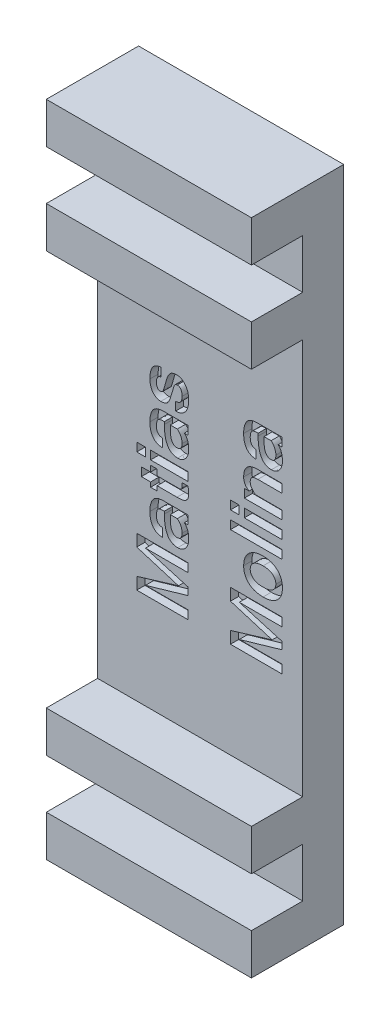
from build123d import *

# Parameters (mm, degrees)
CROQUIS1_W              = 64.2
CROQUIS1_H              = 20
SALIENTE_EXTRUIR1_DEPTH = 4
CROQUIS2_W              = 20
CROQUIS2_H              = 4
SALIENTE_EXTRUIR2_DEPTH = 5
CROQUIS3_W              = 3.653846154
CROQUIS3_H              = 0.833333333
CROQUIS3_W_2            = 0.833333333
CROQUIS3_H_2            = 0.833333334
CROQUIS3_W_3            = 5
CORTAR_EXTRUIR1_DEPTH   = 0.8


with BuildPart() as part:
    # Croquis1 → Saliente-Extruir1 (new body)
    with BuildSketch(Plane(origin=(0, 0, 0), x_dir=(0, 1, 0), z_dir=(0, 0, 1))):
        Rectangle(CROQUIS1_W, CROQUIS1_H)
    extrude(amount=SALIENTE_EXTRUIR1_DEPTH)

    # Croquis2 → Saliente-Extruir2 (add)
    with BuildSketch(Plane.XY.offset(4)):
        with Locations((0, 30.1)):
            Rectangle(CROQUIS2_W, CROQUIS2_H)
        with Locations((0, 21.3)):
            Rectangle(CROQUIS2_W, CROQUIS2_H)
        with Locations((0, -21.3)):
            Rectangle(CROQUIS2_W, CROQUIS2_H)
        with Locations((0, -30.1)):
            Rectangle(CROQUIS2_W, CROQUIS2_H)
    extrude(amount=SALIENTE_EXTRUIR2_DEPTH)

    # Croquis3 → Cortar-Extruir1 (cut)
    # profile 1 of 14: a face of its own
    with BuildSketch(Plane.XY.offset(4)):
        with BuildLine():
            add(Edge.make_bspline(
                [(-1.115384615, 8.646834936), (-1.11627259, 8.585703378), (-1.117993187, 8.467250931), (-1.133347455, 8.294947443), (-1.157835725, 8.133880089), (-1.192586317, 7.984022228), (-1.237966222, 7.845646553), (-1.292515095, 7.718143105), (-1.358078196, 7.601980122), (-1.433483045, 7.496995907), (-1.519218199, 7.403241303), (-1.614686657, 7.32033401), (-1.7213109, 7.25019565), (-1.83671428, 7.189547373), (-1.962845331, 7.141386501), (-2.099061003, 7.106218821), (-2.244599822, 7.079128982), (-2.345566408, 7.071981279), (-2.397435897, 7.068309295)],
                knots=[0, 0, 0, 0, 1.274858276, 2.470247585, 3.604862061, 4.670716368, 5.674910767, 6.638692114, 7.558604551, 8.451525249, 9.3289138, 10.20284102, 11.081637878, 11.984926025, 12.91737872, 13.890349518, 14.916210823, 16, 16, 16, 16], degree=3))
            Line((-2.397435897, 7.068309295), (-2.397435897, 7.898637821))
            add(Edge.make_bspline(
                [(-2.397435897, 7.898637821), (-2.371366204, 7.899578996), (-2.321076731, 7.901394562), (-2.248001482, 7.910485434), (-2.18004233, 7.924957251), (-2.117300395, 7.946741229), (-2.058907335, 7.971973714), (-2.006150394, 8.004966644), (-1.958047176, 8.042561266), (-1.91551099, 8.086759063), (-1.876903669, 8.135543734), (-1.845582503, 8.19157563), (-1.816548883, 8.251630028), (-1.795643806, 8.31835598), (-1.77649672, 8.38995695), (-1.765948948, 8.46766613), (-1.756774358, 8.550800027), (-1.756534715, 8.608074893), (-1.756410256, 8.637820513)],
                knots=[0, 0, 0, 0, 1.119044826, 2.158681889, 3.156401843, 4.094304959, 5.005000581, 5.879824236, 6.756991382, 7.618216221, 8.50666161, 9.418371056, 10.367046892, 11.363840505, 12.413304224, 13.544028895, 14.724494894, 16, 16, 16, 16], degree=3))
            add(Edge.make_bspline(
                [(-1.756410256, 8.637820513), (-1.757485609, 8.694385955), (-1.759503524, 8.800531886), (-1.786159906, 8.948332415), (-1.826220855, 9.075387069), (-1.887606141, 9.178014535), (-1.959772308, 9.25832855), (-2.040902678, 9.316571971), (-2.130744351, 9.353228906), (-2.194107208, 9.357044226), (-2.226161859, 9.358974359)],
                knots=[0, 0, 0, 0, 1.411897524, 2.649447631, 3.741983836, 4.722344115, 5.614331132, 6.422426071, 7.201920735, 8, 8, 8, 8], degree=3))
            add(Edge.make_bspline(
                [(-2.226161859, 9.358974359), (-2.256841907, 9.356989049), (-2.315740746, 9.353177698), (-2.398007565, 9.319937587), (-2.464338237, 9.261875993), (-2.505486946, 9.195997442), (-2.535112328, 9.130821811), (-2.558373018, 9.0660706), (-2.585571738, 8.988440194), (-2.61438159, 8.896417762), (-2.646657128, 8.791163436), (-2.678895222, 8.671541616), (-2.715743404, 8.538963513), (-2.752187896, 8.395729559), (-2.789192754, 8.250167123), (-2.830592679, 8.111278517), (-2.873772243, 7.982160333), (-2.917262451, 7.862338343), (-2.962574068, 7.7523435), (-3.009140732, 7.652080877), (-3.058547091, 7.562124963), (-3.108047572, 7.480164261), (-3.164943121, 7.408496537), (-3.230922809, 7.346595932), (-3.3067047, 7.29397982), (-3.393080952, 7.252093486), (-3.488523706, 7.218953069), (-3.593831414, 7.196458101), (-3.708481194, 7.182272142), (-3.788283032, 7.180439138), (-3.829727564, 7.179487179)],
                knots=[0, 0, 0, 0, 0.863129502, 1.657015847, 2.45162784, 3.308260965, 3.826504937, 4.470134582, 5.247372209, 6.14672411, 7.189353247, 8.352192128, 9.640553054, 11.070264348, 12.520572451, 13.876173487, 15.156595342, 16.360126907, 17.470542969, 18.511001246, 19.475940451, 20.364281286, 21.208402056, 22.047782609, 22.90715432, 23.79992581, 24.746917346, 25.749884874, 26.831418294, 28, 28, 28, 28], degree=3))
            add(Edge.make_bspline(
                [(-3.829727564, 7.179487179), (-3.867513296, 7.180711659), (-3.94213595, 7.183129872), (-4.051473525, 7.200180257), (-4.155709243, 7.229427422), (-4.254654037, 7.270743948), (-4.348082321, 7.324448824), (-4.437064282, 7.388902304), (-4.520111165, 7.465730916), (-4.598200282, 7.552702616), (-4.668795521, 7.649239762), (-4.730573282, 7.754113413), (-4.781241569, 7.867380805), (-4.82445594, 7.98707159), (-4.857738581, 8.114440216), (-4.8801984, 8.249220616), (-4.89451535, 8.391452705), (-4.896448259, 8.488880298), (-4.897435897, 8.538661859)],
                knots=[0, 0, 0, 0, 0.937501419, 1.85146193, 2.737974475, 3.618076305, 4.504898495, 5.406382434, 6.338744809, 7.306791239, 8.302692004, 9.30158631, 10.321155683, 11.377232385, 12.45632588, 13.582723878, 14.764869639, 16, 16, 16, 16], degree=3))
            add(Edge.make_bspline(
                [(-4.897435897, 8.538661859), (-4.896830007, 8.599121401), (-4.895656864, 8.716185065), (-4.882013721, 8.885993713), (-4.861924747, 9.044395825), (-4.831543071, 9.191214934), (-4.794074464, 9.327150701), (-4.747011646, 9.451485341), (-4.691946858, 9.564888379), (-4.62779546, 9.666360612), (-4.555155902, 9.756777412), (-4.47341236, 9.835118133), (-4.383819514, 9.903287392), (-4.284646207, 9.958205664), (-4.177499101, 10.002682016), (-4.061923992, 10.035598802), (-3.93761722, 10.056778551), (-3.8518454, 10.061613605), (-3.807692308, 10.064102564)],
                knots=[0, 0, 0, 0, 1.367365615, 2.647536268, 3.851350999, 4.977077753, 6.036310001, 7.037856784, 7.980246229, 8.883318511, 9.747925151, 10.597221918, 11.43858983, 12.28734911, 13.154163106, 14.057772132, 15.000191842, 16, 16, 16, 16], degree=3))
            Line((-3.807692308, 10.064102564), (-3.807692308, 9.234775641))
            add(Edge.make_bspline(
                [(-3.807692308, 9.234775641), (-3.843102295, 9.230708708), (-3.911090884, 9.222900034), (-4.004671901, 9.185508845), (-4.084165932, 9.130210977), (-4.148913241, 9.055507834), (-4.197824703, 8.962117219), (-4.232250556, 8.851183371), (-4.253079954, 8.722395045), (-4.255254168, 8.630561288), (-4.256410256, 8.581730769)],
                knots=[0, 0, 0, 0, 0.959694718, 1.842652138, 2.691195296, 3.554385987, 4.486891277, 5.519795609, 6.681207509, 8, 8, 8, 8], degree=3))
            add(Edge.make_bspline(
                [(-4.256410256, 8.581730769), (-4.255164618, 8.541623125), (-4.252787083, 8.465070155), (-4.237438148, 8.355500636), (-4.209012125, 8.258062107), (-4.172408758, 8.171710964), (-4.121414444, 8.10029961), (-4.054182022, 8.048994237), (-3.973474497, 8.017836318), (-3.915148389, 8.014536562), (-3.884815705, 8.012820513)],
                knots=[0, 0, 0, 0, 1.25823482, 2.401577435, 3.458855629, 4.433896374, 5.332433797, 6.176535344, 7.051701226, 8, 8, 8, 8], degree=3))
            add(Edge.make_bspline(
                [(-3.884815705, 8.012820513), (-3.855948788, 8.01423498), (-3.80182014, 8.016887263), (-3.726930401, 8.039575866), (-3.667105586, 8.080330573), (-3.62877822, 8.128578181), (-3.60483902, 8.180782856), (-3.583262958, 8.235766595), (-3.557863245, 8.306373763), (-3.531544878, 8.393126849), (-3.502545077, 8.495743454), (-3.470648837, 8.613980673), (-3.435227183, 8.748026519), (-3.400240859, 8.894531894), (-3.361432, 9.044054879), (-3.319384999, 9.188359488), (-3.27565097, 9.323439305), (-3.229465049, 9.449043093), (-3.181650497, 9.565116168), (-3.131807472, 9.672108961), (-3.078197131, 9.768782826), (-3.024930867, 9.858446546), (-2.964424293, 9.938377497), (-2.893892743, 10.006487899), (-2.8144739, 10.064671514), (-2.726021405, 10.111586014), (-2.628304451, 10.147949926), (-2.522006448, 10.173306102), (-2.406643333, 10.190049824), (-2.32671919, 10.19153646), (-2.28525641, 10.192307692)],
                knots=[0, 0, 0, 0, 0.813591058, 1.525572814, 2.176145675, 2.826377475, 3.235022827, 3.793015424, 4.493184449, 5.351255931, 6.350143211, 7.501813857, 8.806398842, 10.261703319, 11.751355635, 13.164309599, 14.501806511, 15.756465784, 16.939003115, 18.042997575, 19.084203938, 20.05676159, 20.983728313, 21.903005423, 22.813017982, 23.752771056, 24.718553773, 25.746638945, 26.831008876, 28, 28, 28, 28], degree=3))
            add(Edge.make_bspline(
                [(-2.28525641, 10.192307692), (-2.24542352, 10.191381783), (-2.166568427, 10.189548807), (-2.050892177, 10.16794931), (-1.938985842, 10.137112699), (-1.833162264, 10.089445874), (-1.730757057, 10.03141604), (-1.634037336, 9.958566093), (-1.540832226, 9.873958136), (-1.454598958, 9.775725639), (-1.374697678, 9.667617285), (-1.305085306, 9.549055461), (-1.245715754, 9.421392909), (-1.19805006, 9.284020314), (-1.16101028, 9.137513678), (-1.134143156, 8.982185897), (-1.117869916, 8.817456502), (-1.116226496, 8.704632001), (-1.115384615, 8.646834936)],
                knots=[0, 0, 0, 0, 0.882602084, 1.747241267, 2.602949964, 3.452093025, 4.314826315, 5.209653044, 6.132463519, 7.103174052, 8.104710206, 9.110865097, 10.148167667, 11.22346815, 12.331959974, 13.497398446, 14.717982156, 16, 16, 16, 16], degree=3))
        make_face()
    # profile 2 of 14: a face of its own
    with BuildSketch(Plane.XY.offset(4)):
        with BuildLine():
            add(Edge.make_bspline(
                [(-1.541065705, 5.641025641), (-1.506632787, 5.610657325), (-1.4373662, 5.549567248), (-1.351318666, 5.437889254), (-1.277743229, 5.312693249), (-1.217726148, 5.172664073), (-1.171947917, 5.017939393), (-1.139407892, 4.848876018), (-1.11928097, 4.665279932), (-1.116712673, 4.537981166), (-1.115384615, 4.472155449)],
                knots=[0, 0, 0, 0, 0.855394567, 1.720744712, 2.617573961, 3.561176124, 4.556936916, 5.62402994, 6.771394744, 8, 8, 8, 8], degree=3))
            add(Edge.make_bspline(
                [(-1.115384615, 4.472155449), (-1.116386004, 4.427378505), (-1.118356402, 4.339272441), (-1.132662744, 4.210370954), (-1.155200343, 4.087229016), (-1.188833825, 3.970473831), (-1.230420229, 3.859290192), (-1.282121066, 3.753992884), (-1.342989956, 3.654909102), (-1.413270222, 3.563088961), (-1.489731353, 3.478936677), (-1.573008882, 3.405172765), (-1.662838231, 3.343889143), (-1.757992587, 3.293415131), (-1.858163235, 3.252970727), (-1.964447083, 3.224785315), (-2.076443401, 3.208932509), (-2.152995572, 3.206414632), (-2.192107372, 3.205128205)],
                knots=[0, 0, 0, 0, 1.153781604, 2.270256715, 3.338475667, 4.376179815, 5.397342921, 6.393996888, 7.394543108, 8.38922663, 9.369704209, 10.320783555, 11.249173626, 12.165281484, 13.0919954, 14.027020461, 14.991971372, 16, 16, 16, 16], degree=3))
            add(Edge.make_bspline(
                [(-2.192107372, 3.205128205), (-2.244618657, 3.206937453), (-2.346591614, 3.210450876), (-2.494631807, 3.235448395), (-2.632249137, 3.279098203), (-2.760371662, 3.339084434), (-2.877866481, 3.417384273), (-2.984820125, 3.512603021), (-3.081837258, 3.625040434), (-3.167360893, 3.755194168), (-3.244360579, 3.901485468), (-3.308256513, 4.065951091), (-3.364715006, 4.246138691), (-3.408830765, 4.443984011), (-3.445211996, 4.658189685), (-3.469317688, 4.890373481), (-3.484547474, 5.13934991), (-3.486284597, 5.311140449), (-3.487179487, 5.399639423)],
                knots=[0, 0, 0, 0, 0.878585857, 1.706147509, 2.503042316, 3.287780321, 4.065646792, 4.857176963, 5.677084264, 6.543272501, 7.457907148, 8.438311437, 9.491500693, 10.615026604, 11.827426016, 13.125539691, 14.519203723, 16, 16, 16, 16], degree=3))
            Line((-3.487179487, 5.399639423), (-3.487179487, 5.641025641))
            add(Edge.make_bspline(
                [(-3.487179487, 5.641025641), (-3.531593976, 5.640788735), (-3.614811994, 5.64034485), (-3.731141099, 5.633372615), (-3.830438625, 5.62247029), (-3.91538854, 5.608896877), (-3.989886865, 5.583570691), (-4.054891647, 5.540801034), (-4.113790547, 5.48355978), (-4.155962691, 5.423968134), (-4.184723804, 5.367210105), (-4.204796291, 5.317461325), (-4.220589362, 5.260606691), (-4.232993795, 5.197558322), (-4.244756918, 5.12820534), (-4.250655493, 5.051813497), (-4.256507287, 4.96903767), (-4.256443325, 4.911538353), (-4.256410256, 4.881810897)],
                knots=[0, 0, 0, 0, 1.644116973, 3.08052978, 4.311738224, 5.342108045, 6.26085966, 7.200330182, 8.196856224, 9.28744565, 9.884466287, 10.550093353, 11.269973002, 12.065083005, 12.928719252, 13.872084642, 14.899856358, 16, 16, 16, 16], degree=3))
            add(Edge.make_bspline(
                [(-4.256410256, 4.881810897), (-4.25491331, 4.827261344), (-4.252090931, 4.72441225), (-4.225259555, 4.580380295), (-4.180881689, 4.456511308), (-4.116585521, 4.353410309), (-4.033920981, 4.270524753), (-3.930981991, 4.211920199), (-3.811314108, 4.172882519), (-3.724880697, 4.165523499), (-3.679487179, 4.161658654)],
                knots=[0, 0, 0, 0, 1.25244733, 2.361395547, 3.351831856, 4.258594298, 5.132028351, 6.012309286, 6.95609496, 8, 8, 8, 8], degree=3))
            Line((-3.679487179, 4.161658654), (-3.679487179, 3.333333333))
            add(Edge.make_bspline(
                [(-3.679487179, 3.333333333), (-3.72867053, 3.337479197), (-3.824595624, 3.345565113), (-3.963120795, 3.371776673), (-4.092244296, 3.408913994), (-4.21237657, 3.456454388), (-4.321847291, 3.517584548), (-4.423413227, 3.587391434), (-4.513715916, 3.670767501), (-4.595890799, 3.764214805), (-4.666349591, 3.870348043), (-4.729480652, 3.986240587), (-4.780795149, 4.114282924), (-4.824181151, 4.252828156), (-4.856564324, 4.402768782), (-4.880688445, 4.563312601), (-4.894503086, 4.735335376), (-4.896437392, 4.853741548), (-4.897435897, 4.914863782)],
                knots=[0, 0, 0, 0, 1.050977601, 2.049781577, 2.99746369, 3.91012087, 4.795086313, 5.663286632, 6.529269919, 7.406455359, 8.307986408, 9.23723272, 10.213315296, 11.241396003, 12.326850323, 13.477593605, 14.697913189, 16, 16, 16, 16], degree=3))
            add(Edge.make_bspline(
                [(-4.897435897, 4.914863782), (-4.896332308, 4.974311356), (-4.894184428, 5.090012293), (-4.881656048, 5.258698485), (-4.858533072, 5.417258181), (-4.826790674, 5.565967741), (-4.785718895, 5.704639347), (-4.736090857, 5.833806414), (-4.675288259, 5.951939115), (-4.60766826, 6.062040867), (-4.525966701, 6.160846842), (-4.42727238, 6.245733906), (-4.312850969, 6.316939959), (-4.183119075, 6.375229684), (-4.037740343, 6.420042165), (-3.876528939, 6.451091541), (-3.700056713, 6.471836551), (-3.577054239, 6.473497179), (-3.513221154, 6.474358974)],
                knots=[0, 0, 0, 0, 1.182221406, 2.300920244, 3.360949907, 4.366238217, 5.322011343, 6.234346775, 7.113215819, 7.960524052, 8.799520271, 9.651419869, 10.537431668, 11.470404731, 12.472025255, 13.555313917, 14.731311242, 16, 16, 16, 16], degree=3))
            Line((-3.513221154, 6.474358974), (-1.179487179, 6.474358974))
            Line((-1.179487179, 6.474358974), (-1.179487179, 5.641025641))
            Line((-1.179487179, 5.641025641), (-1.541065705, 5.641025641))
        make_face()
        with BuildLine():
            Line((-2.224158654, 5.641025641), (-2.91025641, 5.641025641))
            Line((-2.91025641, 5.641025641), (-2.91025641, 5.275440705))
            add(Edge.make_bspline(
                [(-2.91025641, 5.275440705), (-2.909543164, 5.225353099), (-2.90816827, 5.12880145), (-2.901489884, 4.988421865), (-2.889066347, 4.857935277), (-2.869294256, 4.737148738), (-2.847290165, 4.625386987), (-2.817887281, 4.523928739), (-2.785650816, 4.431007541), (-2.744792467, 4.349258206), (-2.701681747, 4.275500208), (-2.651742747, 4.212190698), (-2.596307192, 4.158853182), (-2.535989464, 4.114136507), (-2.470087329, 4.079706604), (-2.399166731, 4.055540249), (-2.322879332, 4.041353825), (-2.270293424, 4.039445266), (-2.243189103, 4.038461538)],
                knots=[0, 0, 0, 0, 1.529328906, 2.948019231, 4.289925179, 5.528381479, 6.683893214, 7.764835549, 8.751552507, 9.681565107, 10.550406705, 11.355950243, 12.134535201, 12.892974516, 13.64072085, 14.395038928, 15.172755935, 16, 16, 16, 16], degree=3))
            add(Edge.make_bspline(
                [(-2.243189103, 4.038461538), (-2.203529057, 4.03996469), (-2.128806553, 4.04279674), (-2.025217965, 4.075032265), (-1.937542498, 4.126738736), (-1.869605276, 4.201743651), (-1.818375963, 4.293253691), (-1.781948076, 4.399115164), (-1.75953474, 4.519633725), (-1.757489693, 4.604594372), (-1.756410256, 4.649439103)],
                knots=[0, 0, 0, 0, 1.067041362, 2.010386014, 2.895840859, 3.782028924, 4.706289548, 5.709405297, 6.790956669, 8, 8, 8, 8], degree=3))
            add(Edge.make_bspline(
                [(-1.756410256, 4.649439103), (-1.757844172, 4.698629463), (-1.760701644, 4.796654833), (-1.78710299, 4.941745224), (-1.828197806, 5.083801776), (-1.884925388, 5.220716997), (-1.954292343, 5.348477242), (-2.032599897, 5.463714436), (-2.122752946, 5.561685981), (-2.190687293, 5.614837703), (-2.224158654, 5.641025641)],
                knots=[0, 0, 0, 0, 1.039455182, 2.071401351, 3.108191289, 4.162409493, 5.198694425, 6.177992556, 7.102294042, 8, 8, 8, 8], degree=3))
        make_face(mode=Mode.SUBTRACT)
    # profile 3 of 14: a face of its own
    with BuildSketch(Plane.XY.offset(4)):
        with Locations((-3.006410256, 2.147435898)):
            Rectangle(CROQUIS3_W, CROQUIS3_H)
    # profile 4 of 14: a face of its own
    with BuildSketch(Plane.XY.offset(4)):
        with Locations((-5.762820513, 2.147435898)):
            Rectangle(CROQUIS3_W_2, CROQUIS3_H)
    # profile 5 of 14: a face of its own
    with BuildSketch(Plane.XY.offset(4)):
        with BuildLine():
            add(Edge.make_bspline(
                [(-1.179487179, 1.346153846), (-1.169631898, 1.294822278), (-1.150373381, 1.194513631), (-1.13070007, 1.046389533), (-1.117859115, 0.905008718), (-1.116194447, 0.812993136), (-1.115384615, 0.768229167)],
                knots=[0, 0, 0, 0, 1.076808748, 2.104226135, 3.077739225, 4, 4, 4, 4], degree=3))
            add(Edge.make_bspline(
                [(-1.115384615, 0.768229167), (-1.115666802, 0.735496221), (-1.116214609, 0.671951982), (-1.123360469, 0.579640004), (-1.134975397, 0.493577689), (-1.152150259, 0.414333814), (-1.172983194, 0.341490233), (-1.198706857, 0.275181441), (-1.230161551, 0.215728296), (-1.27596427, 0.145842282), (-1.343516724, 0.072115683), (-1.434007655, -0.000930459), (-1.536631298, -0.052690025), (-1.650211739, -0.085647433), (-1.777335318, -0.103959653), (-1.92075697, -0.117650266), (-2.083153748, -0.126782519), (-2.197770397, -0.127713944), (-2.258213141, -0.128205128)],
                knots=[0, 0, 0, 0, 0.918229514, 1.782552509, 2.595982955, 3.352975044, 4.055555418, 4.720070844, 5.344414967, 5.939395419, 7.06043623, 8.134299426, 9.185867171, 10.261689824, 11.438301623, 12.784292742, 14.30420648, 16, 16, 16, 16], degree=3))
            Line((-2.258213141, -0.128205128), (-4.192307692, -0.128205128))
            Line((-4.192307692, -0.128205128), (-4.192307692, -0.576923077))
            Line((-4.192307692, -0.576923077), (-4.833333333, -0.576923077))
            Line((-4.833333333, -0.576923077), (-4.833333333, -0.128205128))
            Line((-4.833333333, -0.128205128), (-5.730769231, -0.128205128))
            Line((-5.730769231, -0.128205128), (-5.730769231, 0.705128205))
            Line((-5.730769231, 0.705128205), (-4.833333333, 0.705128205))
            Line((-4.833333333, 0.705128205), (-4.833333333, 1.282051282))
            Line((-4.833333333, 1.282051282), (-4.192307692, 1.282051282))
            Line((-4.192307692, 1.282051282), (-4.192307692, 0.705128205))
            Line((-4.192307692, 0.705128205), (-2.244190705, 0.705128205))
            add(Edge.make_bspline(
                [(-2.244190705, 0.705128205), (-2.216477299, 0.705306882), (-2.163703451, 0.70564713), (-2.089200705, 0.708512302), (-2.02338009, 0.713488442), (-1.966480555, 0.720073829), (-1.918386425, 0.729242691), (-1.878535298, 0.738704813), (-1.847187922, 0.750784433), (-1.818964902, 0.77145498), (-1.794147974, 0.799532942), (-1.772584523, 0.835248421), (-1.7584253, 0.873035083), (-1.757081865, 0.899319743), (-1.756410256, 0.912459936)],
                knots=[0, 0, 0, 0, 1.67959369, 3.198402281, 4.517536811, 5.679573791, 6.667760061, 7.482438328, 8.16263397, 8.684827803, 9.587254667, 10.413163521, 11.206710772, 12, 12, 12, 12], degree=3))
            add(Edge.make_bspline(
                [(-1.756410256, 0.912459936), (-1.757032015, 0.940504656), (-1.758401738, 1.002286687), (-1.761722563, 1.102906117), (-1.772021509, 1.219297066), (-1.778828218, 1.302081627), (-1.782451923, 1.346153846)],
                knots=[0, 0, 0, 0, 0.774575125, 1.706375525, 2.778937534, 4, 4, 4, 4], degree=3))
            Line((-1.782451923, 1.346153846), (-1.179487179, 1.346153846))
        make_face()
    # profile 6 of 14: a face of its own
    with BuildSketch(Plane.XY.offset(4)):
        with BuildLine():
            add(Edge.make_bspline(
                [(-1.541065705, -1.923076923), (-1.506632787, -1.953445239), (-1.4373662, -2.014535316), (-1.351318666, -2.12621331), (-1.277743229, -2.251409315), (-1.217726148, -2.391438491), (-1.171947917, -2.546163171), (-1.139407892, -2.715226547), (-1.11928097, -2.898822633), (-1.116712673, -3.026121398), (-1.115384615, -3.091947115)],
                knots=[0, 0, 0, 0, 0.855394567, 1.720744712, 2.617573961, 3.561176124, 4.556936916, 5.62402994, 6.771394744, 8, 8, 8, 8], degree=3))
            add(Edge.make_bspline(
                [(-1.115384615, -3.091947115), (-1.116386004, -3.136724059), (-1.118356402, -3.224830123), (-1.132662744, -3.35373161), (-1.155200343, -3.476873548), (-1.188833825, -3.593628733), (-1.230420229, -3.704812372), (-1.282121066, -3.81010968), (-1.342989956, -3.909193462), (-1.413270222, -4.001013603), (-1.489731353, -4.085165887), (-1.573008882, -4.158929799), (-1.662838231, -4.220213421), (-1.757992587, -4.270687433), (-1.858163235, -4.311131837), (-1.964447083, -4.339317249), (-2.076443401, -4.355170055), (-2.152995572, -4.357687933), (-2.192107372, -4.358974359)],
                knots=[0, 0, 0, 0, 1.153781604, 2.270256715, 3.338475667, 4.376179815, 5.397342921, 6.393996888, 7.394543108, 8.38922663, 9.369704209, 10.320783555, 11.249173626, 12.165281484, 13.0919954, 14.027020461, 14.991971372, 16, 16, 16, 16], degree=3))
            add(Edge.make_bspline(
                [(-2.192107372, -4.358974359), (-2.244618657, -4.357165111), (-2.346591614, -4.353651688), (-2.494631807, -4.328654169), (-2.632249137, -4.285004361), (-2.760371662, -4.22501813), (-2.877866481, -4.146718291), (-2.984820125, -4.051499543), (-3.081837258, -3.93906213), (-3.167360893, -3.808908396), (-3.244360579, -3.662617096), (-3.308256513, -3.498151473), (-3.364715006, -3.317963873), (-3.408830765, -3.120118553), (-3.445211996, -2.905912879), (-3.469317688, -2.673729083), (-3.484547474, -2.424752654), (-3.486284597, -2.252962115), (-3.487179487, -2.164463141)],
                knots=[0, 0, 0, 0, 0.878585857, 1.706147509, 2.503042316, 3.287780321, 4.065646792, 4.857176963, 5.677084264, 6.543272501, 7.457907148, 8.438311437, 9.491500693, 10.615026604, 11.827426016, 13.125539691, 14.519203723, 16, 16, 16, 16], degree=3))
            Line((-3.487179487, -2.164463141), (-3.487179487, -1.923076923))
            add(Edge.make_bspline(
                [(-3.487179487, -1.923076923), (-3.531593976, -1.92331383), (-3.614811994, -1.923757714), (-3.731141099, -1.930729949), (-3.830438625, -1.941632274), (-3.91538854, -1.955205687), (-3.989886865, -1.980531873), (-4.054891647, -2.023301531), (-4.113790547, -2.080542784), (-4.155962691, -2.14013443), (-4.184723804, -2.196892459), (-4.204796291, -2.246641239), (-4.220589362, -2.303495873), (-4.232993795, -2.366544242), (-4.244756918, -2.435897224), (-4.250655493, -2.512289067), (-4.256507287, -2.595064894), (-4.256443325, -2.652564211), (-4.256410256, -2.682291667)],
                knots=[0, 0, 0, 0, 1.644116973, 3.08052978, 4.311738224, 5.342108045, 6.26085966, 7.200330182, 8.196856224, 9.28744565, 9.884466287, 10.550093353, 11.269973002, 12.065083005, 12.928719252, 13.872084642, 14.899856358, 16, 16, 16, 16], degree=3))
            add(Edge.make_bspline(
                [(-4.256410256, -2.682291667), (-4.25491331, -2.73684122), (-4.252090931, -2.839690314), (-4.225259555, -2.983722269), (-4.180881689, -3.107591256), (-4.116585521, -3.210692255), (-4.033920981, -3.293577811), (-3.930981991, -3.352182365), (-3.811314108, -3.391220045), (-3.724880697, -3.398579065), (-3.679487179, -3.40244391)],
                knots=[0, 0, 0, 0, 1.25244733, 2.361395547, 3.351831856, 4.258594298, 5.132028351, 6.012309286, 6.95609496, 8, 8, 8, 8], degree=3))
            Line((-3.679487179, -3.40244391), (-3.679487179, -4.230769231))
            add(Edge.make_bspline(
                [(-3.679487179, -4.230769231), (-3.72867053, -4.226623367), (-3.824595624, -4.218537451), (-3.963120795, -4.192325891), (-4.092244296, -4.15518857), (-4.21237657, -4.107648176), (-4.321847291, -4.046518016), (-4.423413227, -3.97671113), (-4.513715916, -3.893335063), (-4.595890799, -3.799887759), (-4.666349591, -3.693754521), (-4.729480652, -3.577861977), (-4.780795149, -3.44981964), (-4.824181151, -3.311274408), (-4.856564324, -3.161333783), (-4.880688445, -3.000789963), (-4.894503086, -2.828767189), (-4.896437392, -2.710361016), (-4.897435897, -2.649238782)],
                knots=[0, 0, 0, 0, 1.050977601, 2.049781577, 2.99746369, 3.91012087, 4.795086313, 5.663286632, 6.529269919, 7.406455359, 8.307986408, 9.23723272, 10.213315296, 11.241396003, 12.326850323, 13.477593605, 14.697913189, 16, 16, 16, 16], degree=3))
            add(Edge.make_bspline(
                [(-4.897435897, -2.649238782), (-4.896332308, -2.589791209), (-4.894184428, -2.474090271), (-4.881656048, -2.305404079), (-4.858533072, -2.146844383), (-4.826790674, -1.998134823), (-4.785718895, -1.859463217), (-4.736090857, -1.73029615), (-4.675288259, -1.612163449), (-4.60766826, -1.502061697), (-4.525966701, -1.403255722), (-4.42727238, -1.318368659), (-4.312850969, -1.247162605), (-4.183119075, -1.18887288), (-4.037740343, -1.144060399), (-3.876528939, -1.113011023), (-3.700056713, -1.092266013), (-3.577054239, -1.090605385), (-3.513221154, -1.08974359)],
                knots=[0, 0, 0, 0, 1.182221406, 2.300920244, 3.360949907, 4.366238217, 5.322011343, 6.234346775, 7.113215819, 7.960524052, 8.799520271, 9.651419869, 10.537431668, 11.470404731, 12.472025255, 13.555313917, 14.731311242, 16, 16, 16, 16], degree=3))
            Line((-3.513221154, -1.08974359), (-1.179487179, -1.08974359))
            Line((-1.179487179, -1.08974359), (-1.179487179, -1.923076923))
            Line((-1.179487179, -1.923076923), (-1.541065705, -1.923076923))
        make_face()
        with BuildLine():
            Line((-2.224158654, -1.923076923), (-2.91025641, -1.923076923))
            Line((-2.91025641, -1.923076923), (-2.91025641, -2.288661859))
            add(Edge.make_bspline(
                [(-2.91025641, -2.288661859), (-2.909543164, -2.338749466), (-2.90816827, -2.435301114), (-2.901489884, -2.575680699), (-2.889066347, -2.706167288), (-2.869294256, -2.826953826), (-2.847290165, -2.938715577), (-2.817887281, -3.040173825), (-2.785650816, -3.133095023), (-2.744792467, -3.214844358), (-2.701681747, -3.288602356), (-2.651742747, -3.351911866), (-2.596307192, -3.405249382), (-2.535989464, -3.449966057), (-2.470087329, -3.48439596), (-2.399166731, -3.508562315), (-2.322879332, -3.522748739), (-2.270293424, -3.524657298), (-2.243189103, -3.525641026)],
                knots=[0, 0, 0, 0, 1.529328906, 2.948019231, 4.289925179, 5.528381479, 6.683893214, 7.764835549, 8.751552507, 9.681565107, 10.550406705, 11.355950243, 12.134535201, 12.892974516, 13.64072085, 14.395038928, 15.172755935, 16, 16, 16, 16], degree=3))
            add(Edge.make_bspline(
                [(-2.243189103, -3.525641026), (-2.203529057, -3.524137874), (-2.128806553, -3.521305824), (-2.025217965, -3.489070299), (-1.937542498, -3.437363828), (-1.869605276, -3.362358913), (-1.818375963, -3.270848873), (-1.781948076, -3.1649874), (-1.75953474, -3.044468839), (-1.757489693, -2.959508192), (-1.756410256, -2.914663462)],
                knots=[0, 0, 0, 0, 1.067041362, 2.010386014, 2.895840859, 3.782028924, 4.706289548, 5.709405297, 6.790956669, 8, 8, 8, 8], degree=3))
            add(Edge.make_bspline(
                [(-1.756410256, -2.914663462), (-1.757844172, -2.865473101), (-1.760701644, -2.767447731), (-1.78710299, -2.62235734), (-1.828197806, -2.480300788), (-1.884925388, -2.343385567), (-1.954292343, -2.215625322), (-2.032599897, -2.100388128), (-2.122752946, -2.002416583), (-2.190687293, -1.949264861), (-2.224158654, -1.923076923)],
                knots=[0, 0, 0, 0, 1.039455182, 2.071401351, 3.108191289, 4.162409493, 5.198694425, 6.177992556, 7.102294042, 8, 8, 8, 8], degree=3))
        make_face(mode=Mode.SUBTRACT)
    # profile 7 of 14: a face of its own
    with BuildSketch(Plane.XY.offset(4)):
        Polygon((-1.179487179, -5.128205128), (-1.179487179, -5.961538462), (-5.323116987, -5.961538462), (-1.179487179, -7.170472756), (-1.179487179, -7.898637821), (-5.323116987, -9.102564103), (-1.179487179, -9.102564103), (-1.179487179, -9.935897436), (-6.179487179, -9.935897436), (-6.179487179, -8.771033654), (-2.118990385, -7.537059295), (-6.179487179, -6.298076923), (-6.179487179, -5.128205128), align=None)
    # profile 8 of 14: a face of its own
    with BuildSketch(Plane.XY.offset(4)):
        with BuildLine():
            add(Edge.make_bspline(
                [(7.599959936, 9.230769231), (7.634392854, 9.200400914), (7.703659441, 9.139310838), (7.789706975, 9.027632844), (7.863282413, 8.902436839), (7.923299493, 8.762407663), (7.969077724, 8.607682983), (8.001617749, 8.438619607), (8.021744671, 8.255023521), (8.024312968, 8.127724755), (8.025641026, 8.061899038)],
                knots=[0, 0, 0, 0, 0.855394567, 1.720744712, 2.617573961, 3.561176124, 4.556936916, 5.62402994, 6.771394744, 8, 8, 8, 8], degree=3))
            add(Edge.make_bspline(
                [(8.025641026, 8.061899038), (8.024639637, 8.017122095), (8.022669239, 7.929016031), (8.008362897, 7.800114544), (7.985825298, 7.676972606), (7.952191816, 7.560217421), (7.910605412, 7.449033782), (7.858904575, 7.343736474), (7.798035685, 7.244652692), (7.727755419, 7.152832551), (7.651294288, 7.068680267), (7.568016759, 6.994916355), (7.47818741, 6.933632733), (7.383033054, 6.883158721), (7.282862406, 6.842714316), (7.176578558, 6.814528904), (7.06458224, 6.798676099), (6.988030069, 6.796158221), (6.948918269, 6.794871795)],
                knots=[0, 0, 0, 0, 1.153781604, 2.270256715, 3.338475667, 4.376179815, 5.397342921, 6.393996888, 7.394543108, 8.38922663, 9.369704209, 10.320783555, 11.249173626, 12.165281484, 13.0919954, 14.027020461, 14.991971372, 16, 16, 16, 16], degree=3))
            add(Edge.make_bspline(
                [(6.948918269, 6.794871795), (6.896406984, 6.796681043), (6.794434027, 6.800194466), (6.646393834, 6.825191984), (6.508776504, 6.868841793), (6.38065398, 6.928828024), (6.26315916, 7.007127863), (6.156205516, 7.10234661), (6.059188383, 7.214784024), (5.973664748, 7.344937758), (5.896665063, 7.491229058), (5.832769128, 7.655694681), (5.776310635, 7.835882281), (5.732194876, 8.033727601), (5.695813645, 8.247933275), (5.671707953, 8.480117071), (5.656478167, 8.7290935), (5.654741044, 8.900884038), (5.653846154, 8.989383013)],
                knots=[0, 0, 0, 0, 0.878585857, 1.706147509, 2.503042316, 3.287780321, 4.065646792, 4.857176963, 5.677084264, 6.543272501, 7.457907148, 8.438311437, 9.491500693, 10.615026604, 11.827426016, 13.125539691, 14.519203723, 16, 16, 16, 16], degree=3))
            Line((5.653846154, 8.989383013), (5.653846154, 9.230769231))
            add(Edge.make_bspline(
                [(5.653846154, 9.230769231), (5.609431665, 9.230532324), (5.526213647, 9.23008844), (5.409884543, 9.223116205), (5.310587016, 9.21221388), (5.225637101, 9.198640466), (5.151138776, 9.173314281), (5.086133994, 9.130544623), (5.027235094, 9.07330337), (4.98506295, 9.013711723), (4.956301837, 8.956953695), (4.93622935, 8.907204915), (4.920436279, 8.850350281), (4.908031846, 8.787301912), (4.896268723, 8.71794893), (4.890370148, 8.641557086), (4.884518354, 8.55878126), (4.884582316, 8.501281942), (4.884615385, 8.471554487)],
                knots=[0, 0, 0, 0, 1.644116973, 3.08052978, 4.311738224, 5.342108045, 6.26085966, 7.200330182, 8.196856224, 9.28744565, 9.884466287, 10.550093353, 11.269973002, 12.065083005, 12.928719252, 13.872084642, 14.899856358, 16, 16, 16, 16], degree=3))
            add(Edge.make_bspline(
                [(4.884615385, 8.471554487), (4.886112331, 8.417004934), (4.88893471, 8.31415584), (4.915766086, 8.170123885), (4.960143952, 8.046254897), (5.02444012, 7.943153898), (5.10710466, 7.860268342), (5.21004365, 7.801663789), (5.329711533, 7.762626109), (5.416144944, 7.755267089), (5.461538462, 7.751402244)],
                knots=[0, 0, 0, 0, 1.25244733, 2.361395547, 3.351831856, 4.258594298, 5.132028351, 6.012309286, 6.95609496, 8, 8, 8, 8], degree=3))
            Line((5.461538462, 7.751402244), (5.461538462, 6.923076923))
            add(Edge.make_bspline(
                [(5.461538462, 6.923076923), (5.412355111, 6.927222787), (5.316430017, 6.935308702), (5.177904847, 6.961520263), (5.048781345, 6.998657584), (4.928649071, 7.046197978), (4.81917835, 7.107328138), (4.717612414, 7.177135023), (4.627309725, 7.260511091), (4.545134842, 7.353958395), (4.47467605, 7.460091633), (4.411544989, 7.575984177), (4.360230492, 7.704026514), (4.31684449, 7.842571746), (4.284461317, 7.992512371), (4.260337196, 8.153056191), (4.246522555, 8.325078965), (4.244588249, 8.443485137), (4.243589744, 8.504607372)],
                knots=[0, 0, 0, 0, 1.050977601, 2.049781577, 2.99746369, 3.91012087, 4.795086313, 5.663286632, 6.529269919, 7.406455359, 8.307986408, 9.23723272, 10.213315296, 11.241396003, 12.326850323, 13.477593605, 14.697913189, 16, 16, 16, 16], degree=3))
            add(Edge.make_bspline(
                [(4.243589744, 8.504607372), (4.244693333, 8.564054945), (4.246841213, 8.679755883), (4.259369593, 8.848442074), (4.282492569, 9.007001771), (4.314234967, 9.15571133), (4.355306746, 9.294382937), (4.404934784, 9.423550004), (4.465737382, 9.541682705), (4.533357381, 9.651784457), (4.61505894, 9.750590432), (4.713753261, 9.835477495), (4.828174672, 9.906683549), (4.957906566, 9.964973274), (5.103285298, 10.009785755), (5.264496702, 10.040835131), (5.440968928, 10.061580141), (5.563971402, 10.063240769), (5.627804487, 10.064102564)],
                knots=[0, 0, 0, 0, 1.182221406, 2.300920244, 3.360949907, 4.366238217, 5.322011343, 6.234346775, 7.113215819, 7.960524052, 8.799520271, 9.651419869, 10.537431668, 11.470404731, 12.472025255, 13.555313917, 14.731311242, 16, 16, 16, 16], degree=3))
            Line((5.627804487, 10.064102564), (7.961538462, 10.064102564))
            Line((7.961538462, 10.064102564), (7.961538462, 9.230769231))
            Line((7.961538462, 9.230769231), (7.599959936, 9.230769231))
        make_face()
        with BuildLine():
            Line((6.916866987, 9.230769231), (6.230769231, 9.230769231))
            Line((6.230769231, 9.230769231), (6.230769231, 8.865184295))
            add(Edge.make_bspline(
                [(6.230769231, 8.865184295), (6.231482478, 8.815096688), (6.232857371, 8.718545039), (6.239535757, 8.578165454), (6.251959294, 8.447678866), (6.271731385, 8.326892328), (6.293735476, 8.215130577), (6.32313836, 8.113672329), (6.355374826, 8.020751131), (6.396233174, 7.939001795), (6.439343894, 7.865243798), (6.489282895, 7.801934287), (6.54471845, 7.748596772), (6.605036177, 7.703880097), (6.670938312, 7.669450194), (6.74185891, 7.645283839), (6.818146309, 7.631097415), (6.870732217, 7.629188856), (6.897836538, 7.628205128)],
                knots=[0, 0, 0, 0, 1.529328906, 2.948019231, 4.289925179, 5.528381479, 6.683893214, 7.764835549, 8.751552507, 9.681565107, 10.550406705, 11.355950243, 12.134535201, 12.892974516, 13.64072085, 14.395038928, 15.172755935, 16, 16, 16, 16], degree=3))
            add(Edge.make_bspline(
                [(6.897836538, 7.628205128), (6.937496584, 7.62970828), (7.012219088, 7.63254033), (7.115807676, 7.664775854), (7.203483144, 7.716482326), (7.271420365, 7.791487241), (7.322649678, 7.882997281), (7.359077565, 7.988858753), (7.381490901, 8.109377315), (7.383535948, 8.194337961), (7.384615385, 8.239182692)],
                knots=[0, 0, 0, 0, 1.067041362, 2.010386014, 2.895840859, 3.782028924, 4.706289548, 5.709405297, 6.790956669, 8, 8, 8, 8], degree=3))
            add(Edge.make_bspline(
                [(7.384615385, 8.239182692), (7.383181469, 8.288373053), (7.380323997, 8.386398423), (7.353922651, 8.531488814), (7.312827835, 8.673545366), (7.256100253, 8.810460586), (7.186733298, 8.938220832), (7.108425744, 9.053458026), (7.018272695, 9.15142957), (6.950338348, 9.204581293), (6.916866987, 9.230769231)],
                knots=[0, 0, 0, 0, 1.039455182, 2.071401351, 3.108191289, 4.162409493, 5.198694425, 6.177992556, 7.102294042, 8, 8, 8, 8], degree=3))
        make_face(mode=Mode.SUBTRACT)
    # profile 9 of 14: a face of its own
    with BuildSketch(Plane.XY.offset(4)):
        with BuildLine():
            add(Edge.make_bspline(
                [(4.76943109, 3.91025641), (4.727626997, 3.936598547), (4.64591751, 3.988086387), (4.538376943, 4.081096855), (4.446801582, 4.183229707), (4.372022195, 4.295092789), (4.314538605, 4.416755302), (4.273422873, 4.547459278), (4.247630753, 4.687487845), (4.244958247, 4.784207162), (4.243589744, 4.833733974)],
                knots=[0, 0, 0, 0, 1.060377998, 2.072594752, 3.042976425, 3.99990291, 4.952842185, 5.923780443, 6.936835578, 8, 8, 8, 8], degree=3))
            add(Edge.make_bspline(
                [(4.243589744, 4.833733974), (4.244410375, 4.887194848), (4.245999239, 4.990702945), (4.262219095, 5.140810894), (4.289152665, 5.280508707), (4.325977617, 5.410026625), (4.372765237, 5.529804614), (4.432457685, 5.638296612), (4.501860004, 5.73716734), (4.581247711, 5.826343214), (4.672606898, 5.903875304), (4.774060376, 5.97130983), (4.886799141, 6.02730392), (5.009000699, 6.074564067), (5.142275561, 6.110667214), (5.28625096, 6.134634577), (5.44043976, 6.151561713), (5.546958892, 6.153070094), (5.601762821, 6.153846154)],
                knots=[0, 0, 0, 0, 1.180552407, 2.285722701, 3.329987221, 4.319702307, 5.256424696, 6.164011082, 7.047917218, 7.920053932, 8.793561539, 9.687410689, 10.604297947, 11.56848763, 12.577522689, 13.64812166, 14.789962226, 16, 16, 16, 16], degree=3))
            Line((5.601762821, 6.153846154), (7.961538462, 6.153846154))
            Line((7.961538462, 6.153846154), (7.961538462, 5.320512821))
            Line((7.961538462, 5.320512821), (5.627804487, 5.320512821))
            add(Edge.make_bspline(
                [(5.627804487, 5.320512821), (5.595065281, 5.320299539), (5.532174929, 5.319889837), (5.441684494, 5.312033698), (5.358570301, 5.302970082), (5.282750436, 5.288100677), (5.214791724, 5.26755468), (5.15301378, 5.245536194), (5.099564376, 5.216879908), (5.052481198, 5.185005007), (5.012965175, 5.146882621), (4.978266136, 5.10438916), (4.949258099, 5.055711791), (4.924938714, 5.001376315), (4.907473256, 4.940923162), (4.894403321, 4.875258258), (4.88644283, 4.804211312), (4.885237094, 4.754961689), (4.884615385, 4.729567308)],
                knots=[0, 0, 0, 0, 1.425966488, 2.739209144, 3.955396103, 5.068077315, 6.099217322, 7.047608022, 7.919617952, 8.734805705, 9.516868711, 10.302980389, 11.118816917, 11.978483291, 12.889774795, 13.854098512, 14.893517617, 16, 16, 16, 16], degree=3))
            add(Edge.make_bspline(
                [(4.884615385, 4.729567308), (4.886333486, 4.696404155), (4.889843431, 4.628654461), (4.913549697, 4.526752946), (4.954624806, 4.425178729), (5.010893758, 4.323226349), (5.0813448, 4.219711359), (5.168033724, 4.115632776), (5.270840836, 4.011113191), (5.347526211, 3.944769873), (5.387419872, 3.91025641)],
                knots=[0, 0, 0, 0, 0.802887084, 1.640234699, 2.518377877, 3.448029402, 4.4547242, 5.545623712, 6.723171705, 8, 8, 8, 8], degree=3))
            Line((5.387419872, 3.91025641), (7.961538462, 3.91025641))
            Line((7.961538462, 3.91025641), (7.961538462, 3.076923077))
            Line((7.961538462, 3.076923077), (4.307692308, 3.076923077))
            Line((4.307692308, 3.076923077), (4.307692308, 3.91025641))
            Line((4.307692308, 3.91025641), (4.76943109, 3.91025641))
        make_face()
    # profile 10 of 14: a face of its own
    with BuildSketch(Plane.XY.offset(4)):
        with Locations((6.134615385, 1.826923077)):
            Rectangle(CROQUIS3_W, CROQUIS3_H_2)
    # profile 11 of 14: a face of its own
    with BuildSketch(Plane.XY.offset(4)):
        with Locations((3.378205129, 1.826923077)):
            Rectangle(CROQUIS3_W_2, CROQUIS3_H_2)
    # profile 12 of 14: a face of its own
    with BuildSketch(Plane.XY.offset(4)):
        with Locations((5.461538462, 0.160256411)):
            Rectangle(CROQUIS3_W_3, CROQUIS3_H)
    # profile 13 of 14: a face of its own
    with BuildSketch(Plane.XY.offset(4)):
        with BuildLine():
            add(Edge.make_bspline(
                [(4.243589744, -2.662259615), (4.2450138, -2.59573634), (4.247793019, -2.465908059), (4.27275935, -2.276941784), (4.310937474, -2.098109172), (4.367367406, -1.930764398), (4.438757138, -1.773697654), (4.526766705, -1.628049112), (4.628738323, -1.4914264), (4.749001721, -1.368614802), (4.881659617, -1.257528116), (5.026772324, -1.160816556), (5.183438538, -1.079464941), (5.351216973, -1.011721904), (5.531507608, -0.961434501), (5.72244073, -0.924699875), (5.924669106, -0.900625041), (6.063430442, -0.898517217), (6.134615385, -0.897435897)],
                knots=[0, 0, 0, 0, 1.090452259, 2.128150526, 3.120513643, 4.084917242, 5.018376918, 5.944226391, 6.870642326, 7.807691998, 8.756188919, 9.703768821, 10.661325014, 11.64653303, 12.665603943, 13.725440703, 14.833144896, 16, 16, 16, 16], degree=3))
            add(Edge.make_bspline(
                [(6.134615385, -0.897435897), (6.205788334, -0.898635719), (6.34448914, -0.900973915), (6.546520772, -0.923361756), (6.737223478, -0.960291855), (6.916366018, -1.012001581), (7.084478654, -1.078651169), (7.241215871, -1.15963086), (7.386488727, -1.256224775), (7.518309572, -1.367926496), (7.638501339, -1.490663754), (7.741403221, -1.627017904), (7.830612809, -1.772420942), (7.901789832, -1.92979874), (7.958477124, -2.097394517), (7.996334873, -2.276639971), (8.021462989, -2.465902132), (8.02422552, -2.595734332), (8.025641026, -2.662259615)],
                knots=[0, 0, 0, 0, 1.166814134, 2.273870362, 3.328296335, 4.348845276, 5.326903457, 6.289281786, 7.236828417, 8.181095097, 9.118111869, 10.047806077, 10.976451797, 11.909878698, 12.874248436, 13.871924196, 14.909586028, 16, 16, 16, 16], degree=3))
            add(Edge.make_bspline(
                [(8.025641026, -2.662259615), (8.024078194, -2.724763268), (8.021016751, -2.847202171), (7.997716236, -3.026365683), (7.958971812, -3.195843411), (7.904314726, -3.355983193), (7.834669126, -3.506623582), (7.747292441, -3.646800045), (7.645500638, -3.777612715), (7.52975057, -3.898943592), (7.398954361, -4.007407924), (7.254733618, -4.101876066), (7.098449724, -4.182295419), (6.929049311, -4.24601382), (6.748315632, -4.297699967), (6.554366128, -4.332651621), (6.348506506, -4.355537278), (6.207129921, -4.357809101), (6.134615385, -4.358974359)],
                knots=[0, 0, 0, 0, 1.043718316, 2.044548112, 3.011707371, 3.942796005, 4.86583473, 5.777296559, 6.695285181, 7.629990289, 8.572431248, 9.526692423, 10.504308453, 11.501590079, 12.544831607, 13.639616171, 14.789317635, 16, 16, 16, 16], degree=3))
            add(Edge.make_bspline(
                [(6.134615385, -4.358974359), (6.061767139, -4.357818167), (5.92005695, -4.355569051), (5.713855536, -4.332670298), (5.519939536, -4.297634896), (5.338673697, -4.246122012), (5.169717048, -4.1813316), (5.013067644, -4.101776285), (4.868950028, -4.007445559), (4.738779465, -3.897905897), (4.622769051, -3.776613459), (4.520740616, -3.646109489), (4.435066176, -3.505492889), (4.364343838, -3.355561324), (4.310690377, -3.195369067), (4.271325945, -3.026084838), (4.248253129, -2.847190872), (4.245165793, -2.72475945), (4.243589744, -2.662259615)],
                knots=[0, 0, 0, 0, 1.216200671, 2.365850061, 3.460585038, 4.503779314, 5.50822308, 6.478291759, 7.432509712, 8.378480899, 9.313143671, 10.231090714, 11.13958984, 12.057536883, 12.993861456, 13.955544493, 14.956328958, 16, 16, 16, 16], degree=3))
        make_face()
        with BuildLine():
            add(Edge.make_bspline(
                [(7.384615385, -2.66025641), (7.383582764, -2.626499094), (7.381569578, -2.560686169), (7.367857065, -2.463988661), (7.34168184, -2.372910236), (7.309890989, -2.284900322), (7.26462083, -2.203555937), (7.211131849, -2.126520074), (7.147685449, -2.054252151), (7.074672838, -1.987170413), (6.991699726, -1.926754103), (6.899401501, -1.873173028), (6.796019008, -1.829787514), (6.683747922, -1.792192089), (6.56082207, -1.764810965), (6.428285864, -1.744984244), (6.285747399, -1.732883083), (6.187390754, -1.73148891), (6.13661859, -1.730769231)],
                knots=[0, 0, 0, 0, 0.922335858, 1.798176735, 2.658927752, 3.50760975, 4.348363878, 5.193460467, 6.066065936, 6.969814693, 7.896559577, 8.86496219, 9.878158919, 10.953996205, 12.095672492, 13.31336823, 14.61314801, 16, 16, 16, 16], degree=3))
            add(Edge.make_bspline(
                [(6.13661859, -1.730769231), (6.085844416, -1.731490629), (5.987151131, -1.73289286), (5.844309599, -1.745032917), (5.710907735, -1.764472287), (5.588181653, -1.793733908), (5.474457686, -1.82932657), (5.371648737, -1.874465285), (5.277770189, -1.926692512), (5.195012507, -1.98802051), (5.121487778, -2.055197265), (5.058218484, -2.127588049), (5.004292672, -2.204223833), (4.961085094, -2.286199465), (4.926973641, -2.372877313), (4.901392524, -2.464362242), (4.887745488, -2.561019101), (4.885669666, -2.626831293), (4.884615385, -2.66025641)],
                knots=[0, 0, 0, 0, 1.384444076, 2.69104004, 3.90662156, 5.05724697, 6.128395134, 7.151810513, 8.114019048, 9.051881599, 9.954061227, 10.825151639, 11.668780934, 12.503767524, 13.345773839, 14.205030382, 15.088359327, 16, 16, 16, 16], degree=3))
            add(Edge.make_bspline(
                [(4.884615385, -2.66025641), (4.885602271, -2.690031243), (4.887542883, -2.748580475), (4.902189288, -2.834531617), (4.924949124, -2.917421617), (4.958413727, -2.996567144), (5.000552623, -3.072530516), (5.053507506, -3.143812103), (5.115032624, -3.212023112), (5.184982567, -3.277790521), (5.266038454, -3.336926884), (5.358936083, -3.387201128), (5.462001849, -3.430042613), (5.576201439, -3.464665572), (5.700579116, -3.493185165), (5.836400779, -3.511030997), (5.982801236, -3.523665242), (6.084170773, -3.524967334), (6.13661859, -3.525641026)],
                knots=[0, 0, 0, 0, 0.835109148, 1.642158655, 2.440020689, 3.242106711, 4.047414304, 4.871893444, 5.727712852, 6.622635291, 7.561448236, 8.534192063, 9.579858393, 10.688113894, 11.879053227, 13.156262101, 14.528671929, 16, 16, 16, 16], degree=3))
            add(Edge.make_bspline(
                [(6.13661859, -3.525641026), (6.188733129, -3.524971118), (6.289437094, -3.523676616), (6.435162069, -3.510970494), (6.570653565, -3.49317403), (6.694727143, -3.464790719), (6.808309477, -3.430143045), (6.910645537, -3.386602539), (7.003994765, -3.337636966), (7.083953295, -3.277351561), (7.154515598, -3.213064603), (7.216014735, -3.144673197), (7.268416708, -3.072668716), (7.310590994, -2.996815661), (7.344482245, -2.918175272), (7.367138055, -2.83520786), (7.381617489, -2.74890315), (7.383608525, -2.690028907), (7.384615385, -2.66025641)],
                knots=[0, 0, 0, 0, 1.465056179, 2.831013508, 4.110924967, 5.304384339, 6.406020444, 7.445242074, 8.428282719, 9.361509967, 10.251964367, 11.109594697, 11.943411057, 12.750422689, 13.545551292, 14.345101608, 15.163123753, 16, 16, 16, 16], degree=3))
        make_face(mode=Mode.SUBTRACT)
    # profile 14 of 14: a face of its own
    with BuildSketch(Plane.XY.offset(4)):
        Polygon((7.961538462, -5.128205128), (7.961538462, -5.961538462), (3.817908654, -5.961538462), (7.961538462, -7.170472756), (7.961538462, -7.898637821), (3.817908654, -9.102564103), (7.961538462, -9.102564103), (7.961538462, -9.935897436), (2.961538462, -9.935897436), (2.961538462, -8.771033654), (7.022035256, -7.537059295), (2.961538462, -6.298076923), (2.961538462, -5.128205128), align=None)
    extrude(amount=-CORTAR_EXTRUIR1_DEPTH, mode=Mode.SUBTRACT)


solid = part.part
